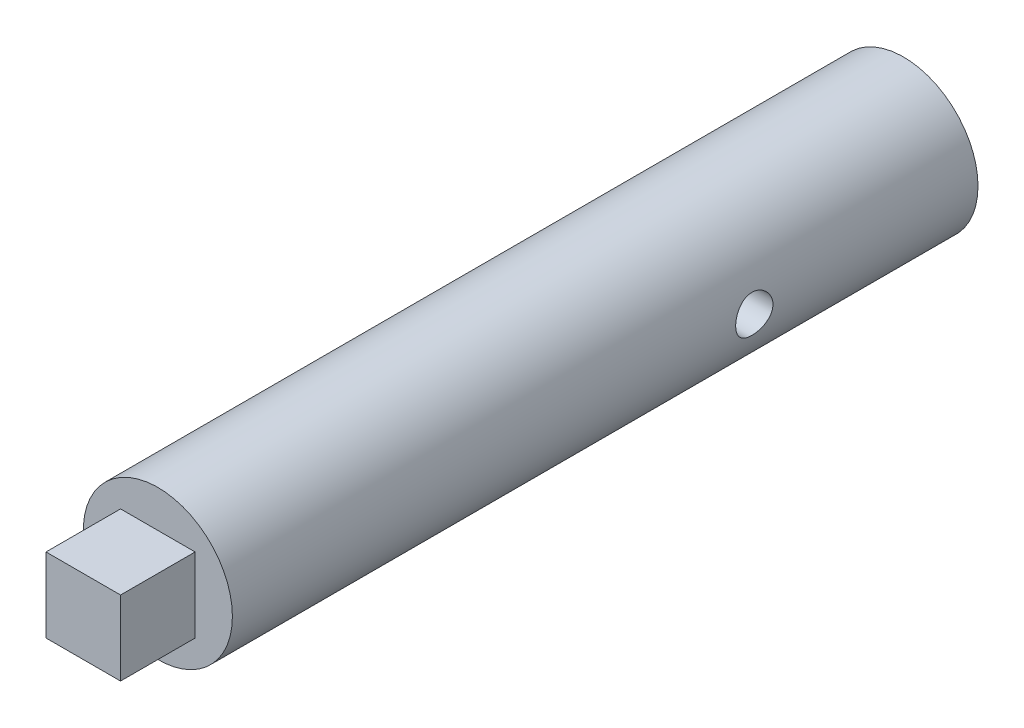
from build123d import *

# Parameters (mm, degrees)
SKETCH1_R               = 5
BOSS_EXTRUDE1_DEPTH     = 50
SKETCH2_W               = 5
SKETCH2_H               = 5
BOSS_EXTRUDE2_DEPTH     = 5
CUT_EXTRUDE1_DEPTH      = 5
CUT_EXTRUDE1_DEPTH_BACK = 5
SKETCH5_R               = 1.25


with BuildPart() as part:
    # Sketch1 → Boss-Extrude1 (new body)
    with BuildSketch(Plane.XY):
        Circle(SKETCH1_R)
    extrude(amount=BOSS_EXTRUDE1_DEPTH)

    # Sketch2 → Boss-Extrude2 (add)
    with BuildSketch(Plane.XY.offset(50)):
        Rectangle(SKETCH2_W, SKETCH2_H)
    extrude(amount=BOSS_EXTRUDE2_DEPTH)

    # Sketch5 → Cut-Extrude1 (cut, two sides: drawn at the far end of the back side and taken through both)
    with BuildSketch(Plane(origin=(0, 0, 0), x_dir=(0, 0, -1), z_dir=(1, 0, 0)).offset(-CUT_EXTRUDE1_DEPTH_BACK)):
        with Locations(Location((-15, 0, 0), (0, 0, 180))):
            Circle(SKETCH5_R)
    extrude(amount=CUT_EXTRUDE1_DEPTH + CUT_EXTRUDE1_DEPTH_BACK, mode=Mode.SUBTRACT)


solid = part.part
